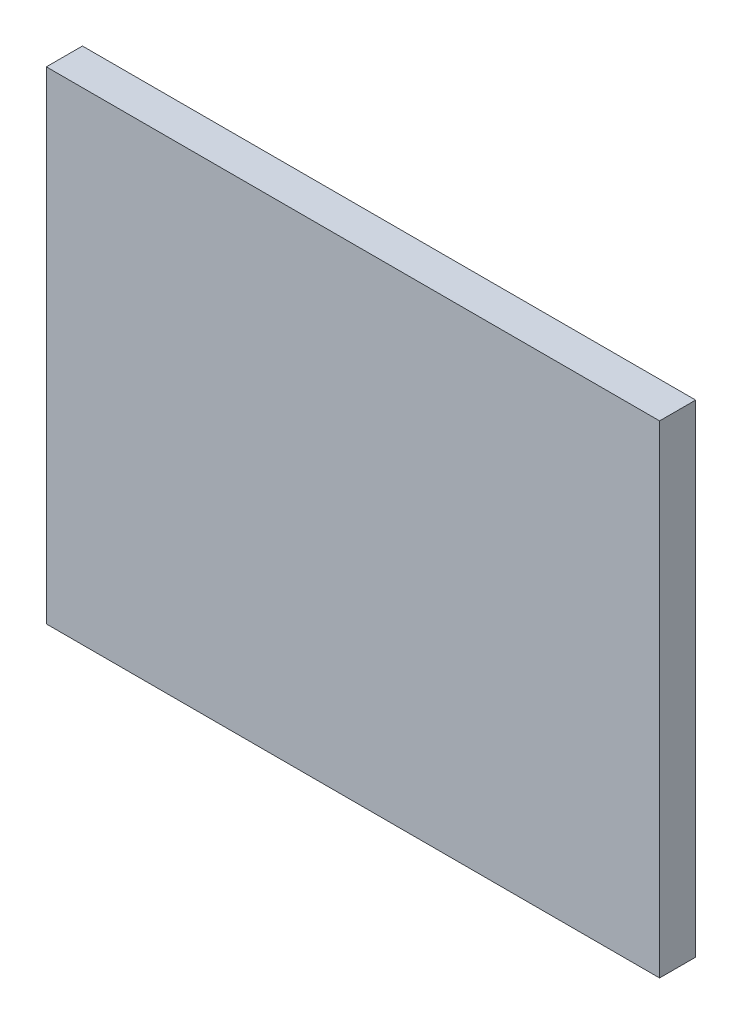
from build123d import *

# Parameters (mm, degrees)
SKETCH1_W           = 215.9
SKETCH1_H           = 169.8625
BOSS_EXTRUDE1_DEPTH = 12.7


with BuildPart() as part:
    # Sketch1 → Boss-Extrude1 (new body)
    with BuildSketch(Plane.XY):
        Rectangle(SKETCH1_W, SKETCH1_H)
    extrude(amount=BOSS_EXTRUDE1_DEPTH)


solid = part.part
